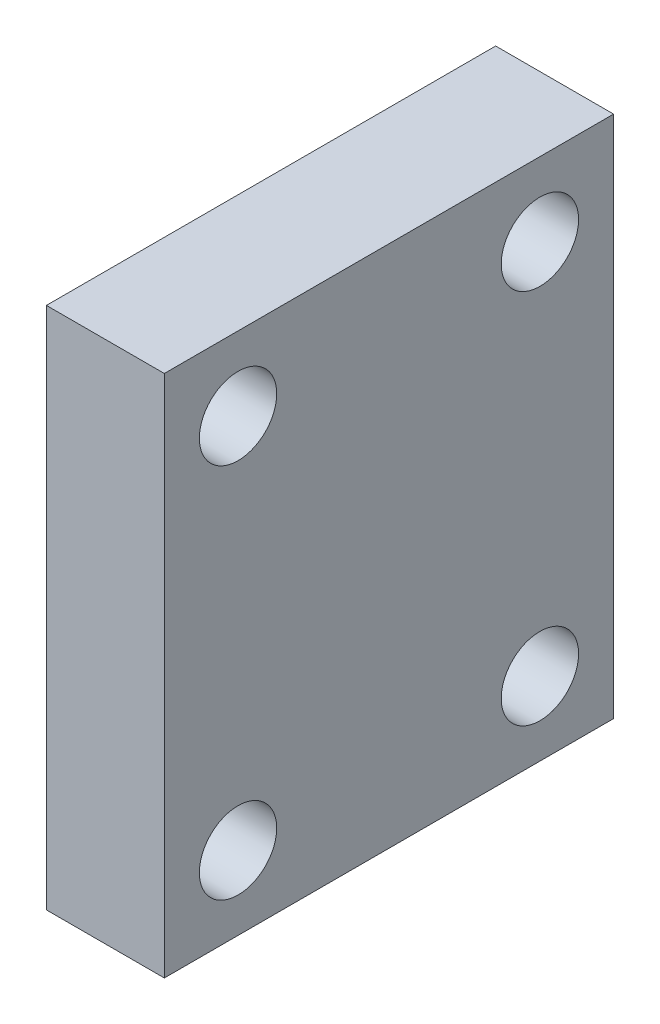
from build123d import *

# Parameters (mm, degrees)
SKETCH1_W           = 112.776
SKETCH1_H           = 96.774
BOSS_EXTRUDE1_DEPTH = 25.4
SKETCH2_R           = 8.334375
CUT_EXTRUDE2_DEPTH  = 151.760715215
SKETCH3_R           = 11.509375
CUT_EXTRUDE3_DEPTH  = 12.7
SKETCH4_R           = 11.509375
CUT_EXTRUDE4_DEPTH  = 12.7
SKETCH5_R           = 16.6497
CUT_EXTRUDE5_DEPTH  = 2.8194
SKETCH6_R           = 3.571875
CUT_EXTRUDE6_DEPTH  = 7.874
SKETCH8_R           = 3.175
CUT_EXTRUDE9_DEPTH  = 7.874


with BuildPart() as part:
    # Sketch1 → Boss-Extrude1 (new body)
    with BuildSketch(Plane.YZ):
        with Locations((56.388, 48.387)):
            Rectangle(SKETCH1_W, SKETCH1_H)
    extrude(amount=BOSS_EXTRUDE1_DEPTH)

    # Sketch2 → Cut-Extrude2 (cut, through all)
    with BuildSketch(Plane.YZ):
        with Locations(Location((15.875, 15.875, 0), (0, 0, 270))):
            Circle(SKETCH2_R)
        with Locations(Location((96.901, 15.875, 0), (0, 0, 270))):
            Circle(SKETCH2_R)
        with Locations(Location((15.875, 80.899, 0), (0, 0, 270))):
            Circle(SKETCH2_R)
        with Locations(Location((96.901, 80.899, 0), (0, 0, 270))):
            Circle(SKETCH2_R)
    extrude(amount=CUT_EXTRUDE2_DEPTH, mode=Mode.SUBTRACT)

    # Sketch3 → Cut-Extrude3 (cut)
    with BuildSketch(Plane.YZ):
        with Locations(Location((28.575, 48.387, 0), (0, 0, 270))):
            Circle(SKETCH3_R)
        with Locations(Location((74.549, 48.387, 0), (0, 0, 270))):
            Circle(SKETCH3_R)
    extrude(amount=CUT_EXTRUDE3_DEPTH, mode=Mode.SUBTRACT)

    # Sketch4 → Cut-Extrude4 (cut)
    with BuildSketch(Plane.YZ):
        with Locations((38.227, 48.387)):
            Circle(SKETCH4_R)
        with Locations((84.201, 48.387)):
            Circle(SKETCH4_R)
    extrude(amount=CUT_EXTRUDE4_DEPTH, mode=Mode.SUBTRACT)

    # Sketch5 → Cut-Extrude5 (cut)
    with BuildSketch(Plane.YZ):
        with Locations((38.227, 48.387)):
            Circle(SKETCH5_R)
        with Locations((84.201, 48.387)):
            Circle(SKETCH5_R)
    extrude(amount=CUT_EXTRUDE5_DEPTH, mode=Mode.SUBTRACT)

    # Sketch6 → Cut-Extrude6 (cut)
    with BuildSketch(Plane.YZ):
        with Locations(Location((105.537, 48.387, 0), (0, 0, 270))):
            Circle(SKETCH6_R)
        with Locations(Location((56.515, 15.875, 0), (0, 0, 270))):
            Circle(SKETCH6_R)
    extrude(amount=CUT_EXTRUDE6_DEPTH, mode=Mode.SUBTRACT)

    # Sketch8 → Cut-Extrude9 (cut)
    with BuildSketch(Plane.YZ):
        with Locations(Location((7.239, 48.387, 0), (0, 0, 270))):
            Circle(SKETCH8_R)
        with Locations(Location((56.261, 80.899, 0), (0, 0, 270))):
            Circle(SKETCH8_R)
    extrude(amount=CUT_EXTRUDE9_DEPTH, mode=Mode.SUBTRACT)


solid = part.part
